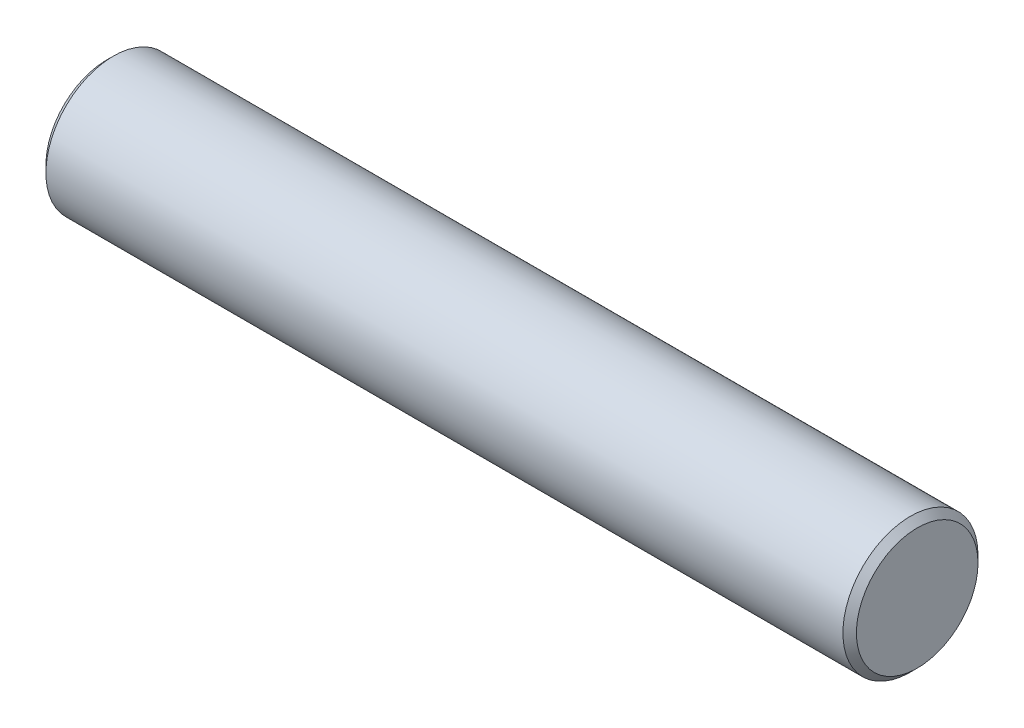
from build123d import *

# Parameters (mm, degrees)
SKETCH1_R           = 1
BOSS_EXTRUDE1_DEPTH = 12
CHAMFER1_SIZE       = 0.1


with BuildPart() as part:
    # Sketch1 → Boss-Extrude1 (new body)
    with BuildSketch(Plane(origin=(0, 0, 0), x_dir=(0, 0, -1), z_dir=(1, 0, 0))):
        Circle(SKETCH1_R)
    extrude(amount=BOSS_EXTRUDE1_DEPTH)

    # Chamfer1
    chamfer1_edges = [part.edges().sort_by_distance(p)[0] for p in [
        (0, 0, 1),
        (12, 0, 1),
    ]]
    chamfer(chamfer1_edges, length=CHAMFER1_SIZE)


solid = part.part
